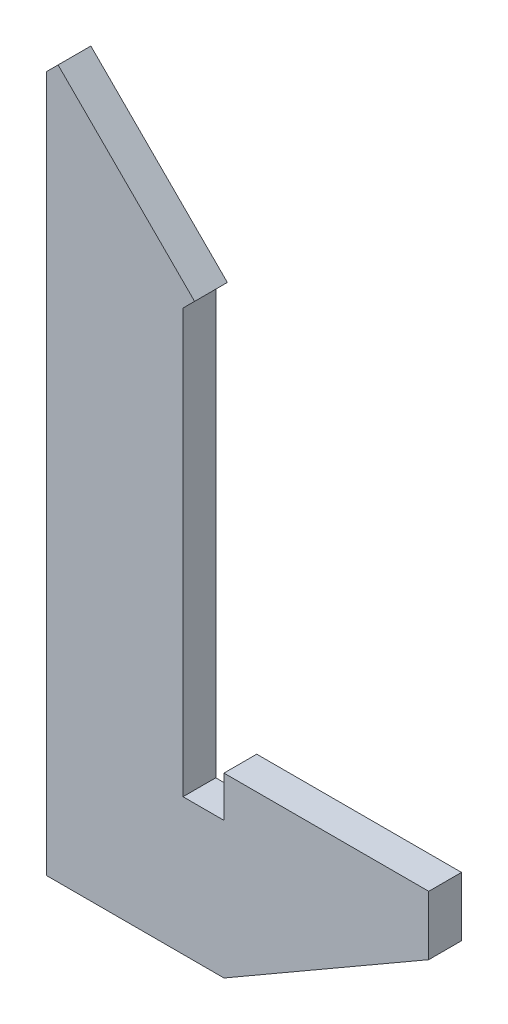
from build123d import *

# Parameters (mm, degrees)
BOSS_EXTRUDE1_DEPTH = 0.12


with BuildPart() as part:
    # Sketch1 → Boss-Extrude1 (new, symmetric)
    with BuildSketch(Plane.XY):
        Polygon((0, 0), (-1.5, 0), (-1.5, -0.3), (-1.8, -0.3), (-1.8, 2.8), (-1.715147186, 2.884852814), (-2.715147186, 3.884852814), (-2.8, 3.8), (-2.8, -1.3), (-1.5, -1.3), (0, -0.433974596), align=None)
    extrude(amount=BOSS_EXTRUDE1_DEPTH, both=True)


solid = part.part
